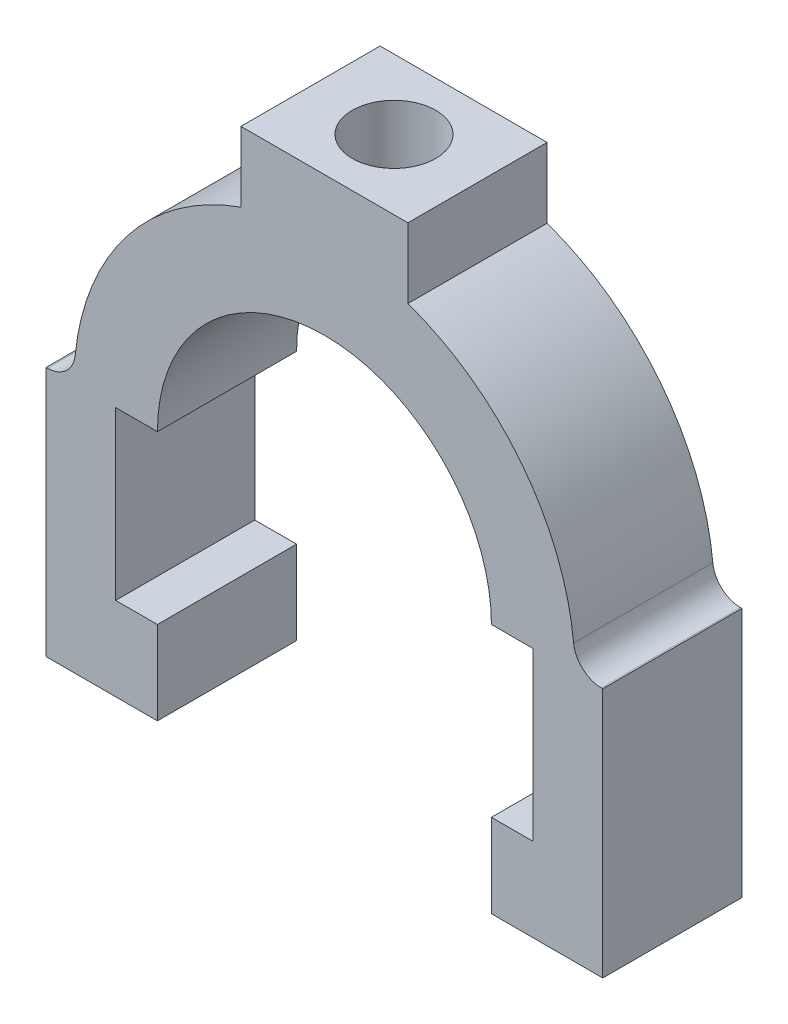
from build123d import *

# Parameters (mm, degrees)
BOSS_EXTRUDE1_DEPTH = 20
FILLET1_R           = 4
SKETCH3_R           = 6
CUT_EXTRUDE2_DEPTH  = 92.651513899


with BuildPart() as part:
    # Sketch2 → Boss-Extrude1 (new body)
    with BuildSketch(Plane.XY):
        with BuildLine():
            Line((-36, 0), (-40, 0))
            Line((-40, 0), (-40, -36))
            Line((-40, -36), (-24, -36))
            Line((-24, -36), (-24, -24))
            Line((-24, -24), (-30, -24))
            Line((-30, -24), (-30, 0))
            Line((-30, 0), (-24, 0))
            ThreePointArc((-24, 0), (0, 24), (24, 0))
            Line((24, 0), (30, 0))
            Line((30, 0), (30, -24))
            Line((30, -24), (24, -24))
            Line((24, -24), (24, -36))
            Line((24, -36), (40, -36))
            Line((40, -36), (40, 0))
            Line((40, 0), (36, 0))
            ThreePointArc((36, 0), (29.393876913, 20.784609691), (12, 33.941125497))
            Line((12, 33.941125497), (12, 44))
            Line((12, 44), (-12, 44))
            Line((-12, 44), (-12, 33.941125497))
            ThreePointArc((-12, 33.941125497), (-29.393876913, 20.784609691), (-36, 0))
        make_face()
    extrude(amount=-BOSS_EXTRUDE1_DEPTH)

    # Fillet1
    fillet1_edges = [part.edges().sort_by_distance(p)[0] for p in [
        (-36, 0, -10),
        (36, 0, -10),
    ]]
    fillet(fillet1_edges, radius=FILLET1_R)

    # Sketch3 → Cut-Extrude2 (cut, through all)
    with BuildSketch(Plane(origin=(0, 44, 0), x_dir=(1, 0, 0), z_dir=(0, 1, 0))):
        with Locations(Location((0, 10, 0), (0, 0, 270))):
            Circle(SKETCH3_R)
    extrude(amount=-CUT_EXTRUDE2_DEPTH, mode=Mode.SUBTRACT)


solid = part.part
